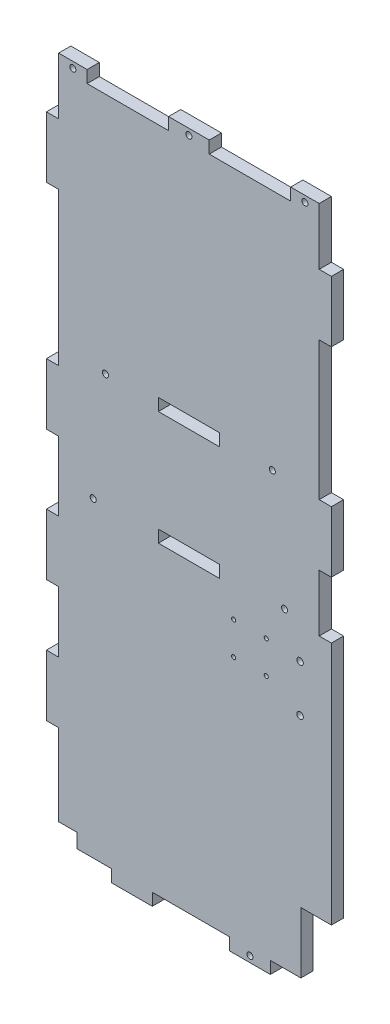
from build123d import *

# Parameters (mm, degrees)
BOSS_EXTRU_1_DEPTH      = 6
ESQUISSE2_R             = 1.5
ESQUISSE2_W             = 30
ESQUISSE2_H             = 6
ENL_V_MAT_EXTRU_1_DEPTH = 226.720818795
ESQUISSE5_R             = 2.995
ENL_V_MAT_EXTRU_2_DEPTH = 3
ESQUISSE6_R             = 1.005
ENL_V_MAT_EXTRU_3_DEPTH = 226.720818795
ESQUISSE7_R             = 2
ENL_V_MAT_EXTRU_4_DEPTH = 2
ESQUISSE8_W             = 15
ESQUISSE8_H             = 30
ESQUISSE8_W_2           = 9
ESQUISSE8_H_2           = 7
ENL_V_MAT_EXTRU_5_DEPTH = 226.720818795
ESQUISSE13_R            = 1.6
ENL_V_MAT_EXTRU_7_DEPTH = 6
ESQUISSE14_W            = 15
ESQUISSE14_H            = 6
ESQUISSE14_R            = 1.6
ENL_V_MAT_EXTRU_8_DEPTH = 2


with BuildPart() as part:
    # Esquisse1 → Boss.-Extru.1 (new body)
    with BuildSketch(Plane.XY):
        Polygon((-67.628238976, -36.290343107), (-67.628238976, -70.290343107), (-73.628238976, -70.290343107), (-73.628238976, -100.290343107), (-67.628238976, -100.290343107), (-67.628238976, -130.290343107), (-73.628238976, -130.290343107), (-73.628238976, -160.290343107), (-67.628238976, -160.290343107), (-67.628238976, -207.290343107), (-41.628238976, -207.290343107), (-41.628238976, -213.290343107), (-21.628238976, -213.290343107), (-21.628238976, -207.290343107), (16.371761024, -207.290343107), (16.371761024, -213.290343107), (36.371761024, -213.290343107), (36.371761024, -207.290343107), (66.371761024, -207.290343107), (66.371761024, -57.290343107), (60.371761024, -57.290343107), (60.371761024, -29.290343107), (66.371761024, -29.290343107), (66.371761024, 0.709656893), (60.371761024, 0.709656893), (60.371761024, 68.709656893), (66.371761024, 68.709656893), (66.371761024, 98.709656893), (60.371761024, 98.709656893), (60.371761024, 126.709656893), (46.371761024, 126.709656893), (46.371761024, 120.709656893), (6.371761024, 120.709656893), (6.371761024, 126.709656893), (-13.628238976, 126.709656893), (-13.628238976, 120.709656893), (-53.628238976, 120.709656893), (-53.628238976, 126.709656893), (-67.628238976, 126.709656893), (-67.628238976, 98.709656893), (-73.628238976, 98.709656893), (-73.628238976, 68.709656893), (-67.628238976, 68.709656893), (-67.628238976, -6.290343107), (-73.628238976, -6.290343107), (-73.628238976, -36.290343107), align=None)
    extrude(amount=BOSS_EXTRU_1_DEPTH)

    # Esquisse2 → Enlèv. mat.-Extru.1 (cut, through all)
    with BuildSketch(Plane.XY.offset(6)):
        with Locations((-44.628238976, 1.709656893)):
            Circle(ESQUISSE2_R)
        with Locations((37.371761024, 1.709656893)):
            Circle(ESQUISSE2_R)
        with Locations((43.371761024, -54.290343107)):
            Circle(ESQUISSE2_R)
        with Locations((-50.628238976, -54.290343107)):
            Circle(ESQUISSE2_R)
        with Locations((-3.628238976, 123.709656893)):
            Circle(ESQUISSE2_R)
        with Locations((-60.628238976, 123.709656893)):
            Circle(ESQUISSE2_R)
        with Locations((53.371761024, 123.709656893)):
            Circle(ESQUISSE2_R)
        with Locations((26.371761024, -210.290343107)):
            Circle(ESQUISSE2_R)
        with Locations((-3.628238976, 1.709656893)):
            Rectangle(ESQUISSE2_W, ESQUISSE2_H)
        with Locations((-3.628238976, -54.290343107)):
            Rectangle(ESQUISSE2_W, ESQUISSE2_H)
    extrude(amount=-ENL_V_MAT_EXTRU_1_DEPTH, mode=Mode.SUBTRACT)

    # Esquisse5 → Enlèv. mat.-Extru.2 (cut)
    with BuildSketch(Plane(origin=(0, 0, 0), x_dir=(-1, 0, 0), z_dir=(0, 0, -1))):
        with Locations((-43.371761024, -54.290343107)):
            Circle(ESQUISSE5_R)
        with Locations((50.628238976, -54.290343107)):
            Circle(ESQUISSE5_R)
        with Locations((44.628238976, 1.709656893)):
            Circle(ESQUISSE5_R)
        with Locations((-37.371761024, 1.709656893)):
            Circle(ESQUISSE5_R)
        with Locations((-53.371761024, 123.709656893)):
            Circle(ESQUISSE5_R)
        with Locations((3.628238976, 123.709656893)):
            Circle(ESQUISSE5_R)
        with Locations((60.628238976, 123.709656893)):
            Circle(ESQUISSE5_R)
        with Locations((-26.371761024, -210.290343107)):
            Circle(ESQUISSE5_R)
    extrude(amount=-ENL_V_MAT_EXTRU_2_DEPTH, mode=Mode.SUBTRACT)

    # Esquisse6 → Enlèv. mat.-Extru.3 (cut, through all)
    with BuildSketch(Plane(origin=(0, 0, 0), x_dir=(-1, 0, 0), z_dir=(0, 0, -1))):
        with Locations((-34.371761024, -71.290343107)):
            Circle(ESQUISSE6_R)
        with Locations((-18.361761024, -71.290343107)):
            Circle(ESQUISSE6_R)
        with Locations((-34.371761024, -87.290343107)):
            Circle(ESQUISSE6_R)
        with Locations((-18.361761024, -87.290343107)):
            Circle(ESQUISSE6_R)
    extrude(amount=-ENL_V_MAT_EXTRU_3_DEPTH, mode=Mode.SUBTRACT)

    # Esquisse7 → Enlèv. mat.-Extru.4 (cut)
    with BuildSketch(Plane(origin=(0, 0, 0), x_dir=(-1, 0, 0), z_dir=(0, 0, -1))):
        with Locations((-34.371761024, -71.290343107)):
            Circle(ESQUISSE7_R)
        with Locations((-18.361761024, -71.290343107)):
            Circle(ESQUISSE7_R)
        with Locations((-18.361761024, -87.290343107)):
            Circle(ESQUISSE7_R)
        with Locations((-34.371761024, -87.290343107)):
            Circle(ESQUISSE7_R)
    extrude(amount=-ENL_V_MAT_EXTRU_4_DEPTH, mode=Mode.SUBTRACT)

    # Esquisse8 → Enlèv. mat.-Extru.5 (cut, through all)
    with BuildSketch(Plane(origin=(0, 0, 0), x_dir=(-1, 0, 0), z_dir=(0, 0, -1))):
        with Locations((-58.871761024, -192.290343107)):
            Rectangle(ESQUISSE8_W, ESQUISSE8_H)
        with Locations((63.128238976, -203.790343107)):
            Rectangle(ESQUISSE8_W_2, ESQUISSE8_H_2)
    extrude(amount=-ENL_V_MAT_EXTRU_5_DEPTH, mode=Mode.SUBTRACT)

    # Esquisse13 → Enlèv. mat.-Extru.7 (cut)
    with BuildSketch(Plane(origin=(0, 0, 0), x_dir=(-1, 0, 0), z_dir=(0, 0, -1))):
        with Locations((-50.971761024, -72.790343107)):
            Circle(ESQUISSE13_R)
        with Locations((-50.971761024, -95.790343107)):
            Circle(ESQUISSE13_R)
    extrude(amount=-ENL_V_MAT_EXTRU_7_DEPTH, mode=Mode.SUBTRACT)

    # Esquisse14 → Enlèv. mat.-Extru.8 (cut)
    # profile 1 of 4: a face of its own
    with BuildSketch(Plane(origin=(0, 0, 0), x_dir=(-1, 0, 0), z_dir=(0, 0, -1))):
        with Locations((50.128238976, -146.290343107)):
            Rectangle(ESQUISSE14_W, ESQUISSE14_H)
    # profile 2 of 4: a face of its own
    with BuildSketch(Plane(origin=(0, 0, 0), x_dir=(-1, 0, 0), z_dir=(0, 0, -1))):
        Polygon((-52.214401711, -69.790343107), (-49.729120337, -69.790343107), (-47.971761024, -71.54770242), (-47.971761024, -74.032983794), (-49.729120337, -75.790343107), (-52.214401711, -75.790343107), (-53.971761024, -74.032983794), (-53.971761024, -71.54770242), align=None)
        with Locations((-50.971761024, -72.790343107)):
            Circle(ESQUISSE14_R, mode=Mode.SUBTRACT)
    # profile 3 of 4: a face of its own
    with BuildSketch(Plane(origin=(0, 0, 0), x_dir=(-1, 0, 0), z_dir=(0, 0, -1))):
        with Locations((14.128238976, -146.290343107)):
            Rectangle(ESQUISSE14_W, ESQUISSE14_H)
    # profile 4 of 4: a face of its own
    with BuildSketch(Plane(origin=(0, 0, 0), x_dir=(-1, 0, 0), z_dir=(0, 0, -1))):
        Polygon((-47.971761024, -94.54770242), (-49.729120337, -92.790343107), (-52.214401711, -92.790343107), (-53.971761024, -94.54770242), (-53.971761024, -97.032983794), (-52.214401711, -98.790343107), (-49.729120337, -98.790343107), (-47.971761024, -97.032983794), align=None)
        with Locations((-50.971761024, -95.790343107)):
            Circle(ESQUISSE14_R, mode=Mode.SUBTRACT)
    extrude(amount=-ENL_V_MAT_EXTRU_8_DEPTH, mode=Mode.SUBTRACT)


solid = part.part
